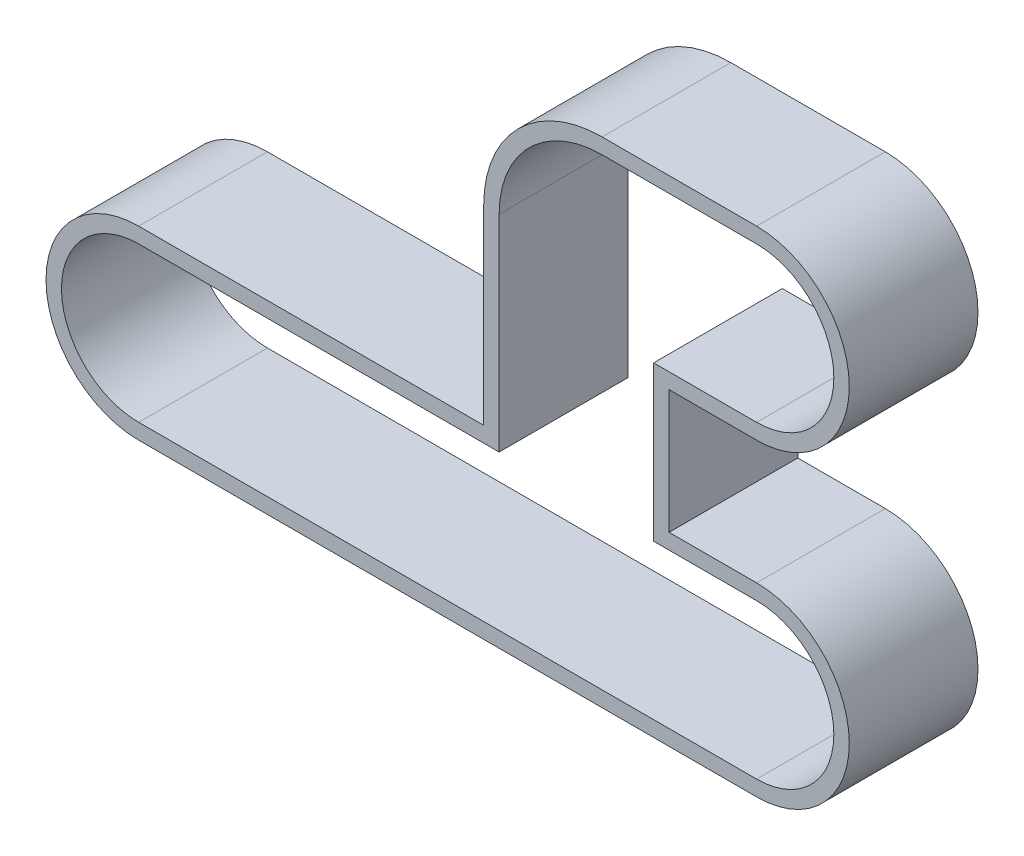
from build123d import *

# Parameters (mm, degrees)
EXTRUDE_THIN11_DEPTH = 25


with BuildPart() as part:
    # Sketch2 → Extrude-Thin11 (new body)
    with BuildSketch(Plane.XY):
        with BuildLine():
            Line((67, 70), (67, 33))
            Line((67, 33), (0, 33))
            ThreePointArc((0, 33), (-18, 15), (0, -3))
            Line((0, -3), (120, -3))
            ThreePointArc((120, -3), (138, 15), (120, 33))
            Line((120, 33), (103, 33))
            Line((103, 33), (103, 57))
            Line((103, 57), (120, 57))
            ThreePointArc((120, 57), (138, 75), (120, 93))
            Line((120, 93), (90, 93))
            ThreePointArc((90, 93), (73.736544033, 86.263455967), (67, 70))
        make_face()
        with BuildLine():
            Line((70, 70), (70, 30))
            Line((70, 30), (0, 30))
            ThreePointArc((0, 30), (-15, 15), (0, 0))
            Line((0, 0), (120, 0))
            ThreePointArc((120, 0), (135, 15), (120, 30))
            Line((120, 30), (100, 30))
            Line((100, 30), (100, 60))
            Line((100, 60), (120, 60))
            ThreePointArc((120, 60), (135, 75), (120, 90))
            Line((120, 90), (90, 90))
            ThreePointArc((90, 90), (75.857864376, 84.142135624), (70, 70))
        make_face(mode=Mode.SUBTRACT)
    extrude(amount=EXTRUDE_THIN11_DEPTH)


solid = part.part
